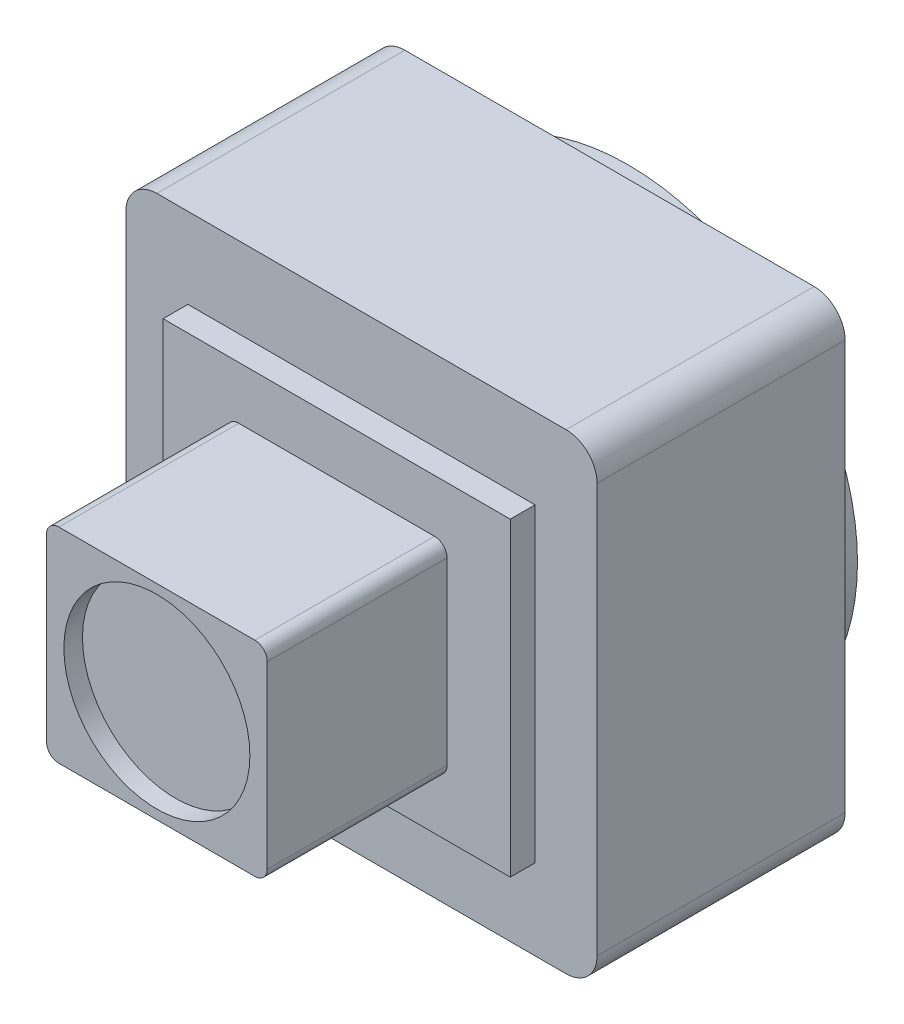
from build123d import *

# Parameters (mm, degrees)
SKETCH1_W           = 96.52
SKETCH1_H           = 96.52
BOSS_EXTRUDE1_DEPTH = 50.8
SKETCH2_W           = 71.12
SKETCH2_H           = 63.5
BOSS_EXTRUDE2_DEPTH = 5.08
SKETCH3_W           = 45.212
SKETCH3_H           = 41.91
BOSS_EXTRUDE3_DEPTH = 36.83
SKETCH4_R           = 19.05
CUT_EXTRUDE1_DEPTH  = 3.81
SKETCH5_R           = 46.99
BOSS_EXTRUDE4_DEPTH = 3.81
FILLET1_R           = 2.54
FILLET2_R           = 6.35


with BuildPart() as part:
    # Sketch1 → Boss-Extrude1 (new body)
    with BuildSketch(Plane.XY):
        Rectangle(SKETCH1_W, SKETCH1_H)
    extrude(amount=BOSS_EXTRUDE1_DEPTH)

    # Sketch2 → Boss-Extrude2 (add)
    with BuildSketch(Plane.XY.offset(50.8)):
        Rectangle(SKETCH2_W, SKETCH2_H)
    extrude(amount=BOSS_EXTRUDE2_DEPTH)

    # Sketch3 → Boss-Extrude3 (add)
    with BuildSketch(Plane.XY.offset(55.88)):
        Rectangle(SKETCH3_W, SKETCH3_H)
    extrude(amount=BOSS_EXTRUDE3_DEPTH)

    # Sketch4 → Cut-Extrude1 (cut)
    with BuildSketch(Plane.XY.offset(92.71)):
        Circle(SKETCH4_R)
    extrude(amount=-CUT_EXTRUDE1_DEPTH, mode=Mode.SUBTRACT)

    # Sketch5 → Boss-Extrude4 (add)
    with BuildSketch(Plane(origin=(0, 0, 0), x_dir=(-1, 0, 0), z_dir=(0, 0, -1))):
        with Locations(Location((0, 0, 0), (0, 0, 180))):
            Circle(SKETCH5_R)
    extrude(amount=BOSS_EXTRUDE4_DEPTH)

    # Fillet1
    fillet1_edges = [part.edges().sort_by_distance(p)[0] for p in [
        (22.606, -20.955, 74.295),
        (22.606, 20.955, 74.295),
        (-22.606, 20.955, 74.295),
        (-22.606, -20.955, 74.295),
    ]]
    fillet(fillet1_edges, radius=FILLET1_R)

    # Fillet2
    fillet2_edges = [part.edges().sort_by_distance(p)[0] for p in [
        (48.26, -48.26, 25.4),
        (-48.26, -48.26, 25.4),
        (-48.26, 48.26, 25.4),
        (48.26, 48.26, 25.4),
    ]]
    fillet(fillet2_edges, radius=FILLET2_R)


solid = part.part
